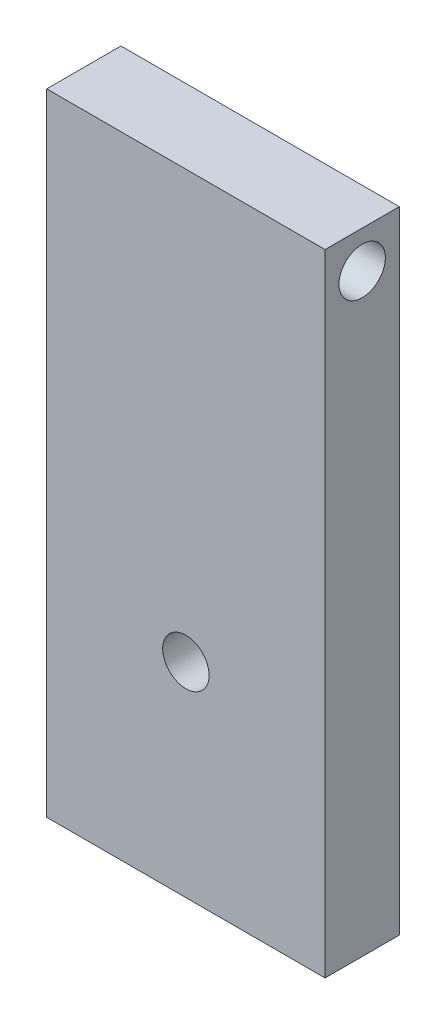
from build123d import *

# Parameters (mm, degrees)
CROQUIS1_W              = 30
CROQUIS1_H              = 68
SALIENTE_EXTRUIR1_DEPTH = 8
CROQUIS2_R              = 2.5
CORTAR_EXTRUIR1_DEPTH   = 47.043457733
CROQUIS3_R              = 2
CORTAR_EXTRUIR2_DEPTH   = 15
CROQUIS4_R              = 2.5
CORTAR_EXTRUIR3_DEPTH   = 39.013155617


with BuildPart() as part:
    # Croquis1 → Saliente-Extruir1 (new body)
    with BuildSketch(Plane.XY):
        Rectangle(CROQUIS1_W, CROQUIS1_H)
    extrude(amount=-SALIENTE_EXTRUIR1_DEPTH)

    # Croquis2 → Cortar-Extruir1 (cut, through all)
    with BuildSketch(Plane(origin=(15, 0, 0), x_dir=(0, 0, -1), z_dir=(1, 0, 0))):
        with Locations(Location((4, 30, 0), (0, 0, 90))):
            Circle(CROQUIS2_R)
    extrude(amount=-CORTAR_EXTRUIR1_DEPTH, mode=Mode.SUBTRACT)

    # Croquis3 → Cortar-Extruir2 (cut)
    with BuildSketch(Plane.XZ.offset(34)):
        with Locations(Location((-10, -4, 0), (0, 0, 270))):
            Circle(CROQUIS3_R)
        with Locations(Location((10, -4, 0), (0, 0, 270))):
            Circle(CROQUIS3_R)
    extrude(amount=-CORTAR_EXTRUIR2_DEPTH, mode=Mode.SUBTRACT)

    # Croquis4 → Cortar-Extruir3 (cut, through all)
    with BuildSketch(Plane.XY):
        with Locations((0, -12)):
            Circle(CROQUIS4_R)
    extrude(amount=-CORTAR_EXTRUIR3_DEPTH, mode=Mode.SUBTRACT)


solid = part.part
